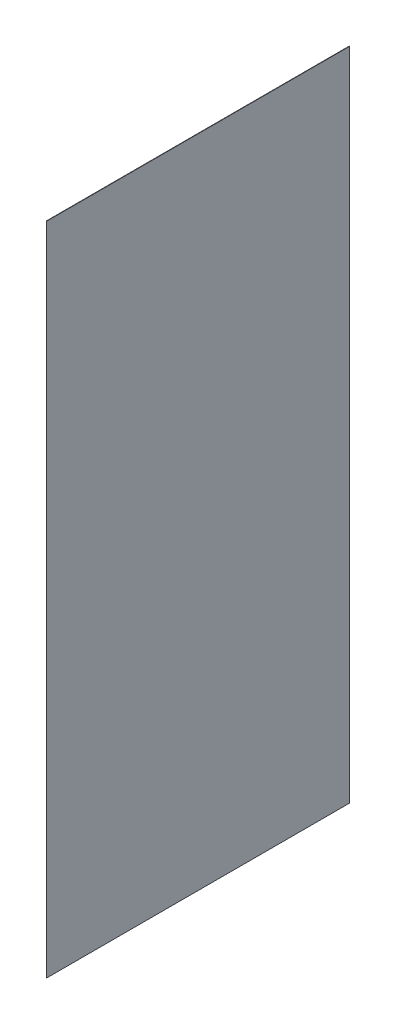
from build123d import *

# Parameters (mm, degrees)
SKETCH1_W                  = 1
SKETCH1_H                  = 1727
TOPPING_IC_YAN_SOL_1_DEPTH = 798.5


with BuildPart() as part:
    # Sketch1 → TOPPING_ic_yan_sol_1 (new body)
    with BuildSketch(Plane.XY):
        with Locations((42, 1105)):
            Rectangle(SKETCH1_W, SKETCH1_H)
    extrude(amount=-TOPPING_IC_YAN_SOL_1_DEPTH)


solid = part.part
